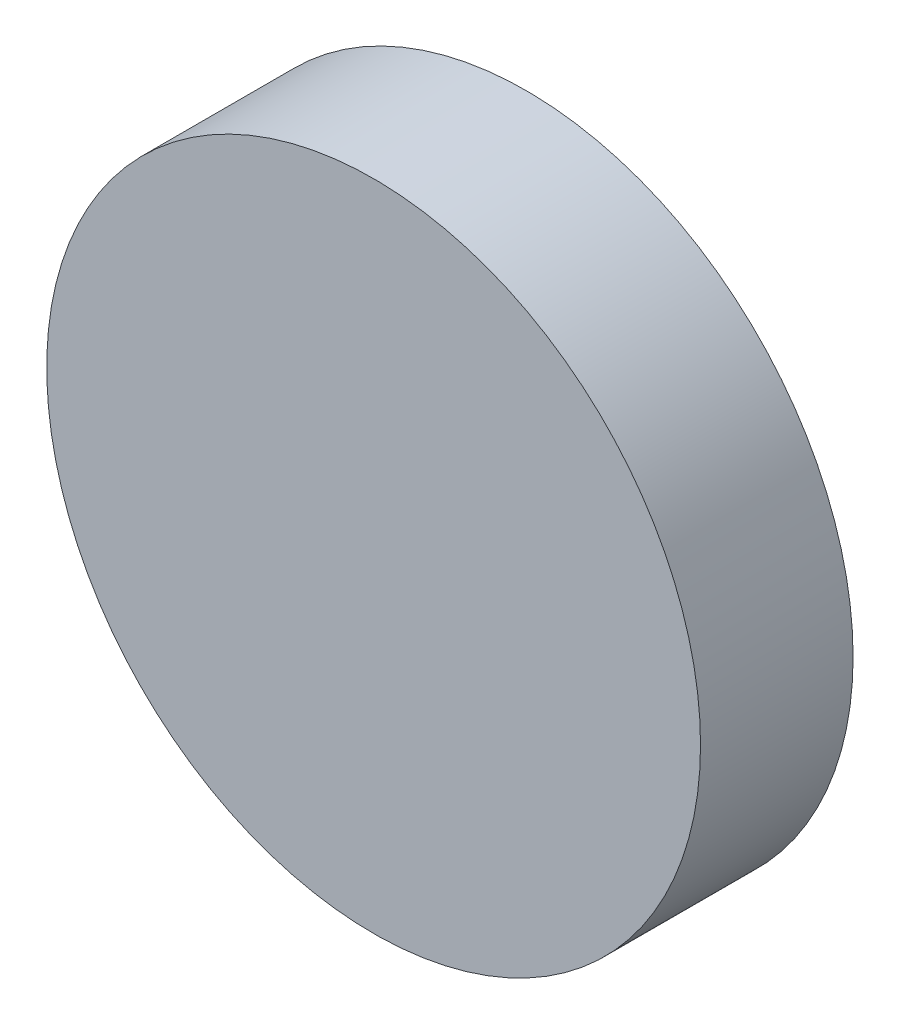
from build123d import *

# Parameters (mm, degrees)
SKETCH_1_R      = 7.5
SKETCH_1_R_2    = 5
EXTRUDE_1_DEPTH = 2
SKETCH_2_R      = 7.5
EXTRUDE_2_DEPTH = 1.5


with BuildPart() as part:
    # 草图1 → 凸台-拉伸1 (new body)
    with BuildSketch(Plane.XY):
        Circle(SKETCH_1_R)
        Circle(SKETCH_1_R_2, mode=Mode.SUBTRACT)
    extrude(amount=EXTRUDE_1_DEPTH)

    # 草图2 → 凸台-拉伸2 (add)
    with BuildSketch(Plane.XY.offset(2)):
        Circle(SKETCH_2_R)
    extrude(amount=EXTRUDE_2_DEPTH)


solid = part.part
